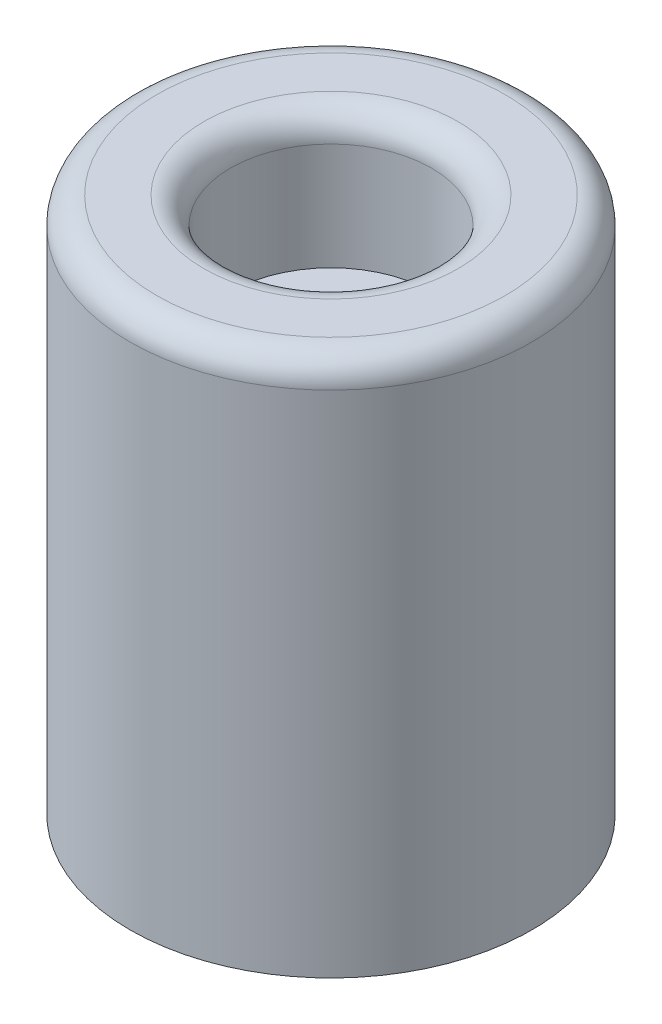
from build123d import *

# Parameters (mm, degrees)
SKETCH1_R           = 9.525
BOSS_EXTRUDE1_DEPTH = 25.4
SKETCH2_R           = 4.7625
CUT_EXTRUDE1_DEPTH  = 6.35
SKETCH3_R           = 1.984375
CUT_EXTRUDE2_DEPTH  = 24.3313898
FILLET1_R           = 1.27


with BuildPart() as part:
    # Sketch1 → Boss-Extrude1 (new body)
    with BuildSketch(Plane(origin=(0, 0, 0), x_dir=(1, 0, 0), z_dir=(0, 1, 0))):
        with Locations(Location((0, 0, 0), (0, 0, 270))):
            Circle(SKETCH1_R)
    extrude(amount=BOSS_EXTRUDE1_DEPTH)

    # Sketch2 → Cut-Extrude1 (cut)
    with BuildSketch(Plane(origin=(0, 25.4, 0), x_dir=(1, 0, 0), z_dir=(0, 1, 0))):
        with Locations(Location((0, 0, 0), (0, 0, 270))):
            Circle(SKETCH2_R)
    extrude(amount=-CUT_EXTRUDE1_DEPTH, mode=Mode.SUBTRACT)

    # Sketch3 → Cut-Extrude2 (cut, through all)
    with BuildSketch(Plane(origin=(0, 19.05, 0), x_dir=(1, 0, 0), z_dir=(0, 1, 0))):
        with Locations(Location((0, 0, 0), (0, 0, 270))):
            Circle(SKETCH3_R)
    extrude(amount=-CUT_EXTRUDE2_DEPTH, mode=Mode.SUBTRACT)

    # Fillet1
    fillet1_edges = [part.edges().sort_by_distance(p)[0] for p in [
        (0, 25.4, -9.525),
        (0, 25.4, -4.7625),
    ]]
    fillet(fillet1_edges, radius=FILLET1_R)


solid = part.part
